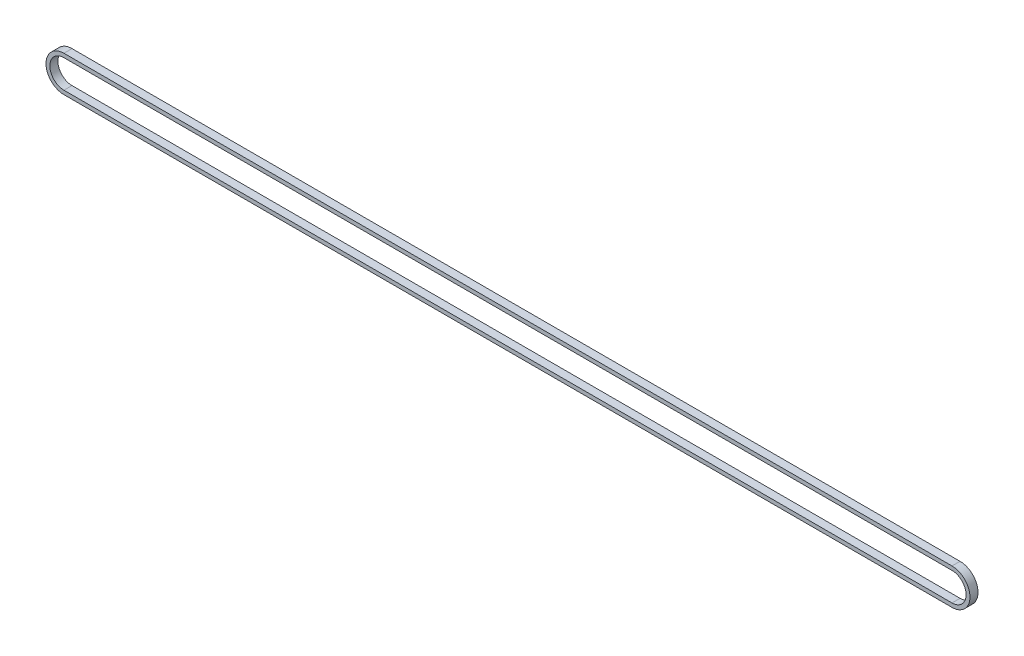
from build123d import *

# Parameters (mm, degrees)
EXTRUDE_THIN1_DEPTH = 2.5


with BuildPart() as part:
    # Sketch1 → Extrude-Thin1 (new, symmetric)
    with BuildSketch(Plane.XY):
        with BuildLine():
            Line((551.8, -11.15), (0, -11.15))
            ThreePointArc((0, -11.15), (-11.15, 0), (0, 11.15))
            Line((0, 11.15), (551.8, 11.15))
            ThreePointArc((551.8, 11.15), (562.95, 0), (551.8, -11.15))
        make_face()
        with BuildLine():
            Line((551.8, -8.75), (0, -8.75))
            ThreePointArc((0, -8.75), (-8.75, 0), (0, 8.75))
            Line((0, 8.75), (551.8, 8.75))
            ThreePointArc((551.8, 8.75), (560.55, 0), (551.8, -8.75))
        make_face(mode=Mode.SUBTRACT)
    extrude(amount=EXTRUDE_THIN1_DEPTH, both=True)


solid = part.part
